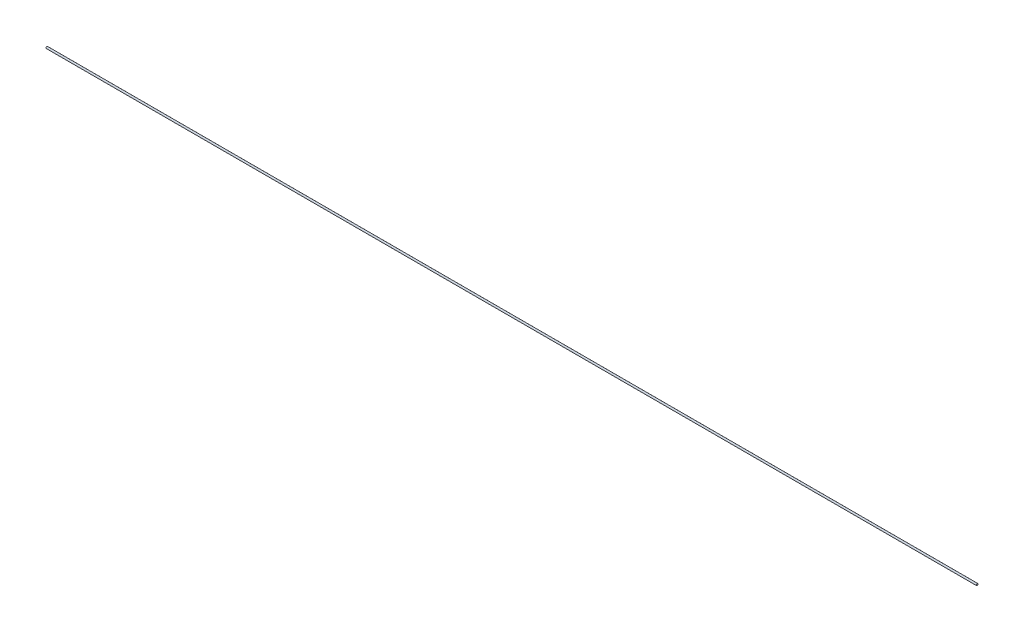
from build123d import *

# Parameters (mm, degrees)
EXTRUDE_1_DEPTH      = 778.215
EXTRUDE_1_DEPTH_BACK = 778.215
SKETCH_1_R           = 1.5


with BuildPart() as part:
    # Эскиз1 → Бобышка-Вытянуть1 (new, two sides: drawn at the far end of the back side and taken through both)
    with BuildSketch(Plane(origin=(0, 0, 0), x_dir=(0, 0, -1), z_dir=(1, 0, 0)).offset(-EXTRUDE_1_DEPTH_BACK)):
        Circle(SKETCH_1_R)
    extrude(amount=EXTRUDE_1_DEPTH + EXTRUDE_1_DEPTH_BACK)


solid = part.part
